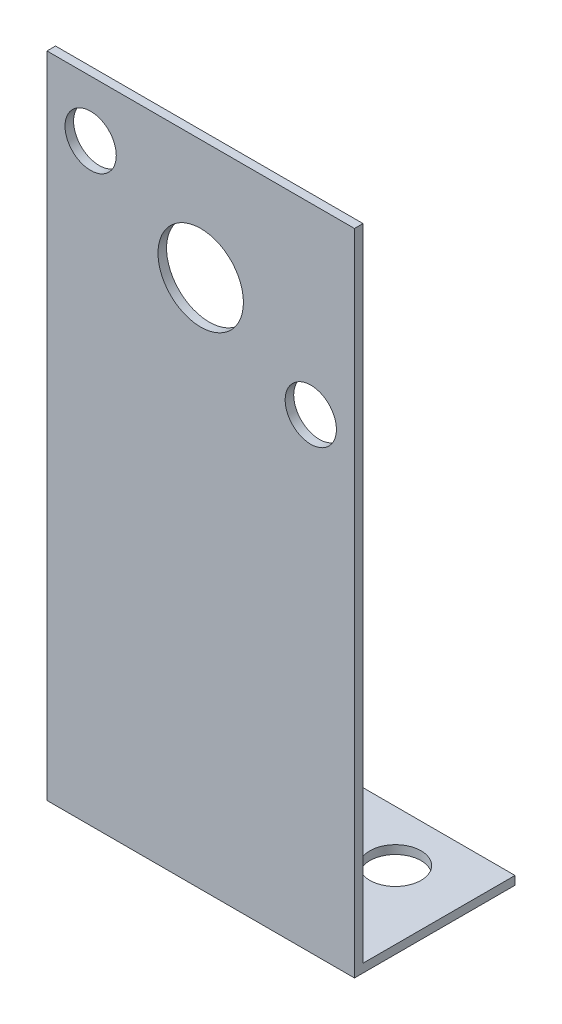
from build123d import *

# Parameters (mm, degrees)
SKETCH1_W      = 18
SKETCH1_H      = 38
SKETCH1_R      = 2.5
EXTRUDE1_DEPTH = 0.5
SKETCH2_W      = 18
SKETCH2_H      = 0.5
EXTRUDE2_DEPTH = 8.9
SKETCH3_R      = 1.5
EXTRUDE3_DEPTH = 0.5
SKETCH4_R      = 1.5
EXTRUDE4_DEPTH = 0.5


with BuildPart() as part:
    # Sketch1 → Extrude1 (new body)
    with BuildSketch(Plane.XY):
        with Locations((0, -12)):
            Rectangle(SKETCH1_W, SKETCH1_H)
        Circle(SKETCH1_R, mode=Mode.SUBTRACT)
    extrude(amount=EXTRUDE1_DEPTH)

    # Sketch2 → Extrude2 (add)
    with BuildSketch(Plane(origin=(0, 0, 0), x_dir=(-1, 0, 0), z_dir=(0, 0, -1))):
        with Locations((0, -30.75)):
            Rectangle(SKETCH2_W, SKETCH2_H)
    extrude(amount=EXTRUDE2_DEPTH)

    # Sketch3 → Extrude3 (cut)
    with BuildSketch(Plane(origin=(0, -30.5, 0), x_dir=(1, 0, 0), z_dir=(0, 1, 0))):
        with Locations(Location((-5, 5.9, 0), (0, 0, 180))):
            Circle(SKETCH3_R)
        with Locations(Location((5, 5.9, 0), (0, 0, 180))):
            Circle(SKETCH3_R)
    extrude(amount=-EXTRUDE3_DEPTH, mode=Mode.SUBTRACT)

    # Sketch4 → Extrude4 (cut)
    with BuildSketch(Plane(origin=(0, 0, 0), x_dir=(-1, 0, 0), z_dir=(0, 0, -1))):
        with Locations((-6.443229004, -3.72)):
            Circle(SKETCH4_R)
        with Locations((6.443229004, 3.72)):
            Circle(SKETCH4_R)
    extrude(amount=-EXTRUDE4_DEPTH, mode=Mode.SUBTRACT)


solid = part.part
